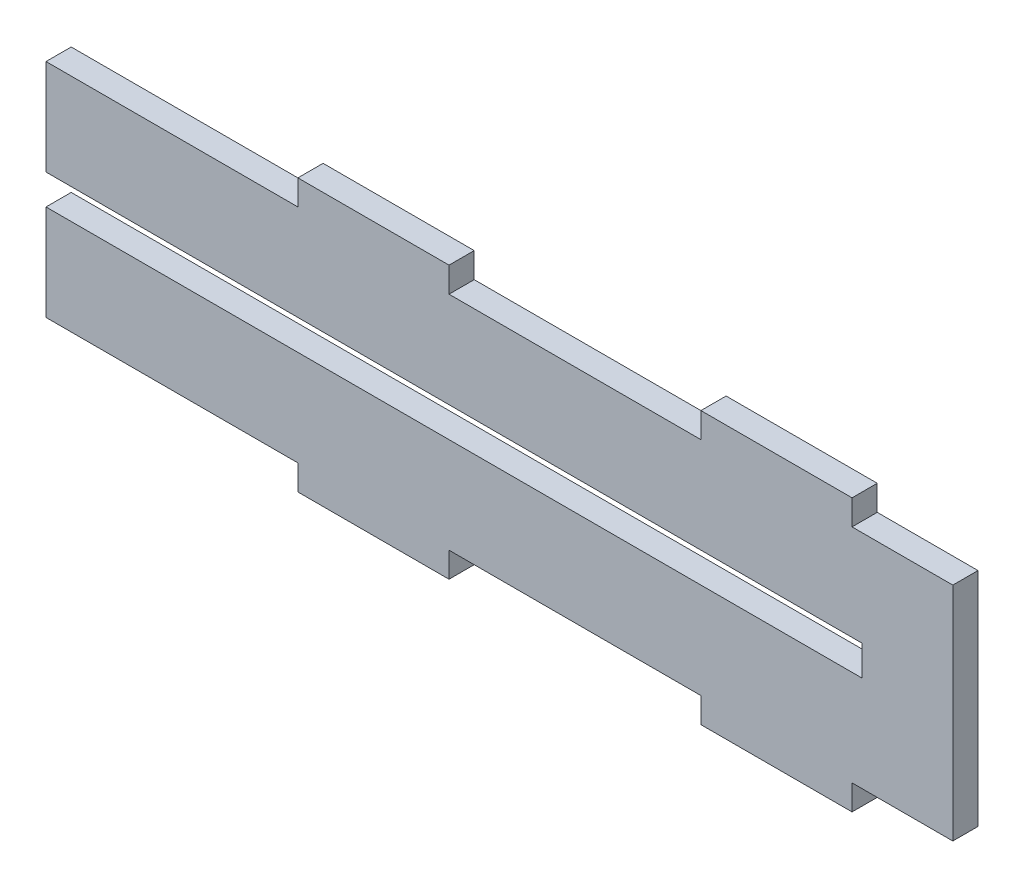
from build123d import *

# Parameters (mm, degrees)
RESSALTO_EXTRUS_O1_DEPTH = 5


with BuildPart() as part:
    # Esboço1 → Ressalto-extrusão1 (new body)
    with BuildSketch(Plane.XY):
        Polygon((0, -25), (0, -44), (50, -44), (50, -49), (80, -49), (80, -44), (130, -44), (130, -49), (160, -49), (160, -44), (180, -44), (180, -22), (162, -22), (162, -25), align=None)
        Polygon((0, 0), (0, -19), (162, -19), (162, -22), (180, -22), (180, 0), (160, 0), (160, 5), (130, 5), (130, 0), (80, 0), (80, 5), (50, 5), (50, 0), align=None)
    extrude(amount=RESSALTO_EXTRUS_O1_DEPTH)


solid = part.part
